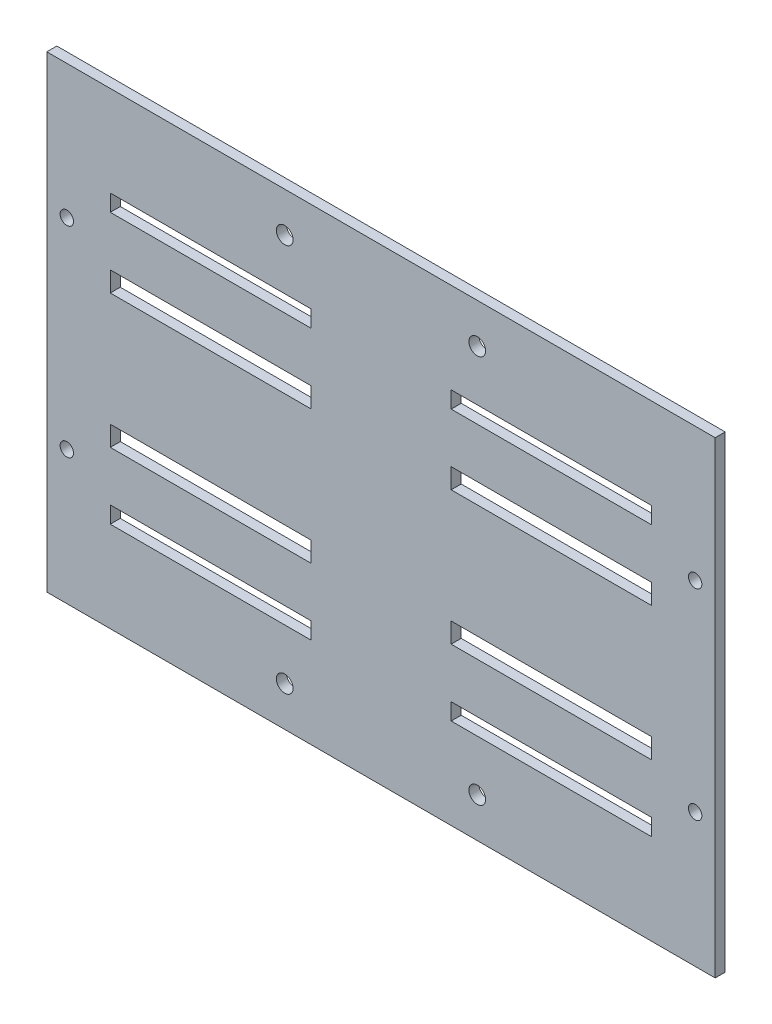
from build123d import *

# Parameters (mm, degrees)
SKETCH_2_W               = 200
SKETCH_2_H               = 140
EXTRUDE_1_DEPTH          = 3
SKETCH_3_R               = 2
CUT_EXTRUDE_1_DEPTH      = 3
SKETCH_4_W               = 60
SKETCH_4_H               = 6
CUT_EXTRUDE_2_DEPTH      = 10
SKETCH_5_W               = 60
SKETCH_5_H               = 5
CUT_EXTRUDE_3_DEPTH      = 6
MIRROR_2_COPY_1_SKETCH_W = 60
MIRROR_2_COPY_1_SKETCH_H = 5
MIRROR_2_COPY_1_DEPTH    = 6
SKETCH_6_R               = 2.5
CUT_EXTRUDE_4_DEPTH      = 5


with BuildPart() as part:
    # 草图2 → 凸台-拉伸1 (new body)
    with BuildSketch(Plane.XY):
        Rectangle(SKETCH_2_W, SKETCH_2_H)
    extrude(amount=EXTRUDE_1_DEPTH)

    # 草图3 → 切除-拉伸1 (cut)
    with BuildSketch(Plane.XY.offset(3)):
        with Locations((94, 30)):
            Circle(SKETCH_3_R)
        with Locations((94, -30)):
            Circle(SKETCH_3_R)
    cut_extrude_1 = extrude(amount=-CUT_EXTRUDE_1_DEPTH, mode=Mode.SUBTRACT)

    # 草图4 → 切除-拉伸2 (cut)
    with BuildSketch(Plane.XY.offset(3)):
        with Locations((51, 20)):
            Rectangle(SKETCH_4_W, SKETCH_4_H)
        with Locations((51, -20)):
            Rectangle(SKETCH_4_W, SKETCH_4_H)
    cut_extrude_2 = extrude(amount=-CUT_EXTRUDE_2_DEPTH, mode=Mode.SUBTRACT)

    # 草图5 → 切除-拉伸3 (cut)
    with BuildSketch(Plane(origin=(0, 0, 0), x_dir=(-1, 0, 0), z_dir=(0, 0, -1))):
        with Locations((-51, 40.40876744)):
            Rectangle(SKETCH_5_W, SKETCH_5_H)
    cut_extrude_3 = extrude(amount=-CUT_EXTRUDE_3_DEPTH, mode=Mode.SUBTRACT)

    # 镜向1: 切除-拉伸3 across plane
    add(cut_extrude_3.mirror(Plane.ZX), mode=Mode.SUBTRACT)

    # 镜向2: 切除-拉伸1, 切除-拉伸2, 切除-拉伸3 across plane
    add(cut_extrude_1.mirror(Plane.ZY), mode=Mode.SUBTRACT)
    add(cut_extrude_2.mirror(Plane.ZY), mode=Mode.SUBTRACT)
    add(cut_extrude_3.mirror(Plane.ZY), mode=Mode.SUBTRACT)

    # 镜向2 copy 1 sketch → 镜向2 copy 1 (cut)
    with BuildSketch(Plane(origin=(0, 0, 0), x_dir=(1, 0, 0), z_dir=(0, 0, -1))):
        with Locations((-51, 40.40876744)):
            Rectangle(MIRROR_2_COPY_1_SKETCH_W, MIRROR_2_COPY_1_SKETCH_H)
    extrude(amount=-MIRROR_2_COPY_1_DEPTH, mode=Mode.SUBTRACT)

    # 草图6 → 切除-拉伸4 (cut)
    with BuildSketch(Plane.XY.offset(3)):
        with Locations((-28.8, 58.108563741)):
            Circle(SKETCH_6_R)
        with Locations((-28.8, -58.108563741)):
            Circle(SKETCH_6_R)
        with Locations((28.8, -58.108563741)):
            Circle(SKETCH_6_R)
        with Locations((28.8, 58.108563741)):
            Circle(SKETCH_6_R)
    extrude(amount=-CUT_EXTRUDE_4_DEPTH, mode=Mode.SUBTRACT)


solid = part.part
